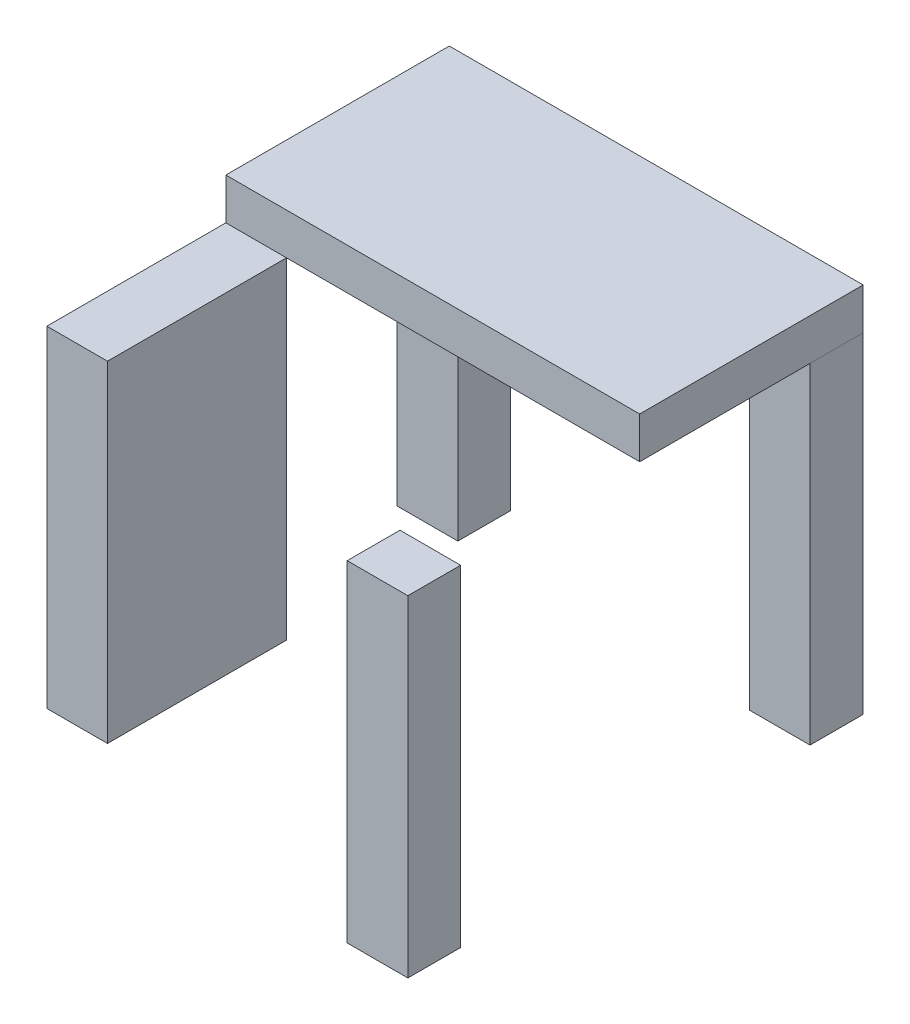
from build123d import *

# Parameters (mm, degrees)
SKETCH1_W           = 100
SKETCH1_H           = 10
BOSS_EXTRUDE1_DEPTH = 54
SKETCH2_W           = 14.657296337
SKETCH2_H           = 12.750406224
SKETCH2_H_2         = 43.249593776
SKETCH2_W_2         = 14.657296336
BOSS_EXTRUDE2_DEPTH = 80


with BuildPart() as part:
    # Sketch1 → Boss-Extrude1 (new body)
    with BuildSketch(Plane.XY):
        with Locations((50, 5)):
            Rectangle(SKETCH1_W, SKETCH1_H)
    extrude(amount=BOSS_EXTRUDE1_DEPTH)

    # Sketch2 → Boss-Extrude2 (add)
    with BuildSketch(Plane.XZ):
        with Locations((92.690459103, 103.659485129)):
            Rectangle(SKETCH2_W, SKETCH2_H)
        with Locations((7.328648169, 75.624796888)):
            Rectangle(SKETCH2_W, SKETCH2_H_2)
        with Locations((7.309540898, 6.193559762)):
            Rectangle(SKETCH2_W, SKETCH2_H)
        with Locations((92.543503994, 6.340514871)):
            Rectangle(SKETCH2_W_2, SKETCH2_H)
    extrude(amount=BOSS_EXTRUDE2_DEPTH)


with BuildPart() as boss_extrude2_piece_1:
    # of the separate pieces the step leaves, piece 1, a body of its own (boss_extrude2_pieces)
    add(part.part.solids().sort_by_distance((0, 0, 12.568762874))[0])


with BuildPart() as boss_extrude2_piece_2:
    # of the separate pieces the step leaves, piece 2, a body of its own (boss_extrude2_pieces)
    add(part.part.solids().sort_by_distance((0, -80, 54))[0])


with BuildPart() as boss_extrude2_piece_3:
    # of the separate pieces the step leaves, piece 3, a body of its own (boss_extrude2_pieces)
    add(part.part.solids().sort_by_distance((85.361810934, 0, 110.034688241))[0])


solid = Compound([boss_extrude2_piece_1.part, boss_extrude2_piece_2.part, boss_extrude2_piece_3.part])
